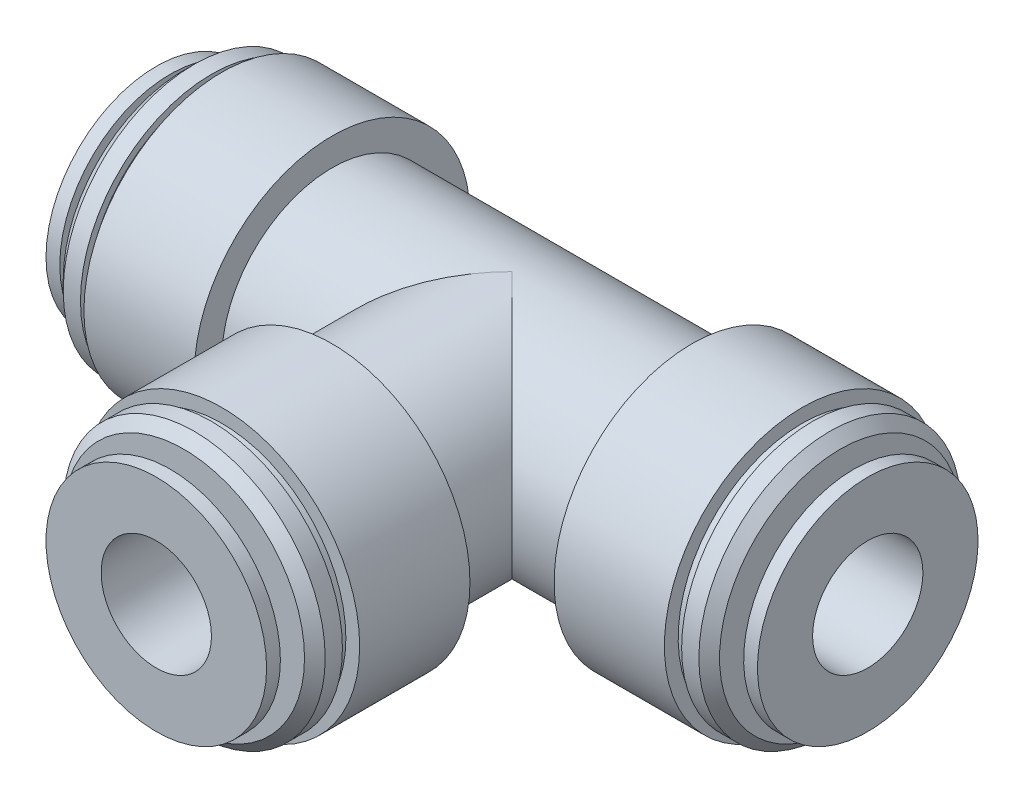
from build123d import *
from build123d.topology import SkipClean

# Parameters (mm, degrees)
SKETCH_2_R          = 8
SKETCH_2_R_2        = 4
EXTRUDE_1_DEPTH     = 26.1
SKETCH_4_R          = 8
EXTRUDE_2_DEPTH     = 13.05
SKETCH_6_R          = 4
CUT_EXTRUDE_1_DEPTH = 63.05
SKETCH_7_R          = 4
CUT_EXTRUDE_2_DEPTH = 25


with BuildPart() as part:
    # Эскиз1 → Повернуть1 (revolve)
    with BuildSketch(Plane.XY, mode=Mode.PRIVATE) as revolve_1_sk:
        Polygon((-16.75, -8), (-16.75, -6), (-15.75, -6), (-15.75, -8.75), (-15, -9.5), (-13.75, -9.5), (-13.75, -9), (-13, -9), (-13, -10), (-5, -10), (-5, -4), (-17.75, -4), (-17.75, -8), align=None)
    revolve(revolve_1_sk.sketch.rotate(Axis((-21.049489232, 0, 0), (1, 0, 0)), 270), axis=Axis((-21.049489232, 0, 0), (1, 0, 0)))

    # Эскиз2 → Бобышка-Вытянуть1 (add)
    with BuildSketch(Plane(origin=(-5, 0, 0), x_dir=(0, 0, -1), z_dir=(1, 0, 0))):
        with Locations(Location((0, 0, 0), (0, 0, 180))):
            Circle(SKETCH_2_R)
        with Locations(Location((0, 0, 0), (0, 0, 180))):
            Circle(SKETCH_2_R_2, mode=Mode.SUBTRACT)
    extrude(amount=EXTRUDE_1_DEPTH)

    # Эскиз3 → Повернуть2 (revolve)
    with SkipClean():  # the faces are left unmerged after this step: merging them gives an invalid solid
        with BuildSketch(Plane.XY):
            Polygon((32.85, 8), (32.85, 6), (31.85, 6), (31.85, 8.75), (31.1, 9.5), (29.85, 9.5), (29.85, 9), (29.1, 9), (29.1, 10), (21.1, 10), (21.1, 4), (33.85, 4), (33.85, 8), align=None)
        revolve(axis=Axis((47.149489232, 0, 0), (-1, 0, 0)))

    # Эскиз4 → Бобышка-Вытянуть2 (add)
    with SkipClean():  # the faces are left unmerged after this step: merging them gives an invalid solid
        with BuildSketch(Plane.XY):
            with Locations(Location((8.05, 0, 0), (0, 0, 90))):
                Circle(SKETCH_4_R)
        extrude(amount=EXTRUDE_2_DEPTH)

    # Эскиз5 → Повернуть3 (revolve)
    with SkipClean():  # the faces are left unmerged after this step: merging them gives an invalid solid
        with BuildSketch(Plane(origin=(0, 0, 0), x_dir=(1, 0, 0), z_dir=(0, 1, 0))):
            Polygon((16.05, -24.8), (14.05, -24.8), (14.05, -23.8), (16.8, -23.8), (17.55, -23.05), (17.55, -21.8), (17.05, -21.8), (17.05, -21.05), (18.05, -21.05), (18.05, -13.05), (12.05, -13.05), (12.05, -25.8), (16.05, -25.8), align=None)
        revolve(axis=Axis((8.05, 0, 29.099489232), (0, 0, -1)))

    # Эскиз6 → Вырез-Вытянуть1 (cut)
    with SkipClean():  # the faces are left unmerged after this step: merging them gives an invalid solid
        with BuildSketch(Plane.ZY.offset(17.75)):
            Circle(SKETCH_6_R)
        extrude(amount=-CUT_EXTRUDE_1_DEPTH, mode=Mode.SUBTRACT)

    # Эскиз7 → Вырез-Вытянуть2 (cut)
    with SkipClean():  # the faces are left unmerged after this step: merging them gives an invalid solid
        with BuildSketch(Plane.XY.offset(25.8)):
            with Locations((8.05, 0)):
                Circle(SKETCH_7_R)
        extrude(amount=-CUT_EXTRUDE_2_DEPTH, mode=Mode.SUBTRACT)


solid = part.part
